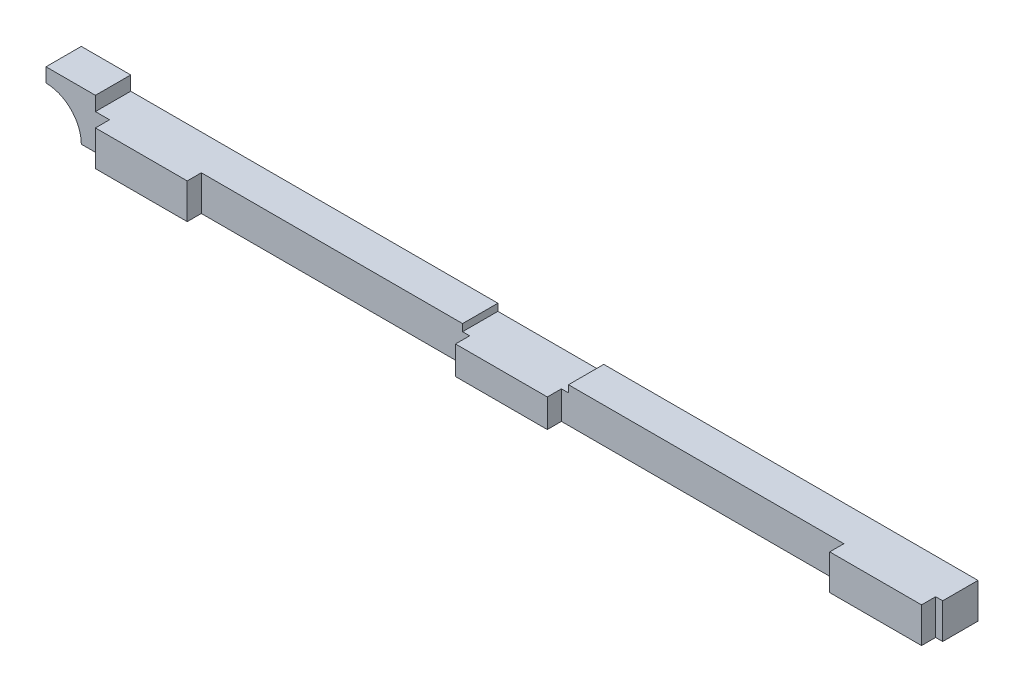
from build123d import *

# Parameters (mm, degrees)
BOSS_EXTRU_1_DEPTH = 5
ESQUISSE3_W        = 13
ESQUISSE3_H        = 5
ESQUISSE3_H_2      = 4
BOSS_EXTRU_2_DEPTH = 2


with BuildPart() as part:
    # Base pièce → Boss.-Extru.1 (new body)
    with BuildSketch(Plane.XY):
        with BuildLine():
            Line((0, 0), (15, 0))
            Line((15, 0), (15, 1))
            Line((15, 1), (68, 1))
            Line((68, 1), (68, -4))
            Line((68, -4), (-54, -4))
            ThreePointArc((-54, -4), (-55.464466094, -0.464466094), (-59, 1))
            Line((-59, 1), (-59, 3))
            Line((-59, 3), (-52, 3))
            Line((-52, 3), (-52, 1))
            Line((-52, 1), (0, 1))
            Line((0, 1), (0, 0))
        make_face()
    extrude(amount=BOSS_EXTRU_1_DEPTH)

    # Esquisse3 → Boss.-Extru.2 (add)
    with BuildSketch(Plane.XY.offset(5)):
        with Locations((-43.5, -1.5)):
            Rectangle(ESQUISSE3_W, ESQUISSE3_H)
        with Locations((7.5, -2)):
            Rectangle(ESQUISSE3_W, ESQUISSE3_H_2)
        with Locations((60.5, -1.5)):
            Rectangle(ESQUISSE3_W, ESQUISSE3_H)
    extrude(amount=BOSS_EXTRU_2_DEPTH)


solid = part.part
